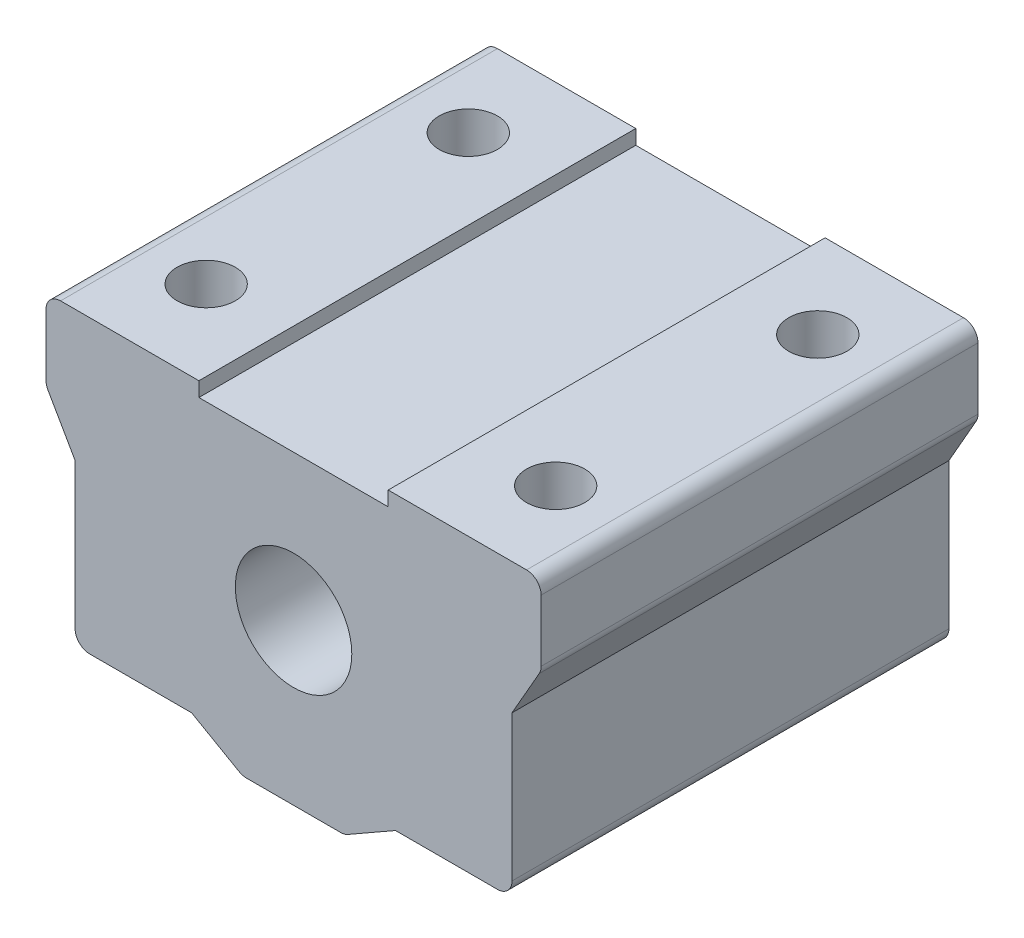
from build123d import *

# Parameters (mm, degrees)
BOSS_EXTRUDE1_DEPTH = 30
FILLET1_R           = 1
CUT_EXTRUDE1_REACH  = 42.902
SKETCH2_R           = 4
CUT_EXTRUDE2_REACH  = 42.902
SKETCH3_R           = 2
SKETCH4_W           = 13
SKETCH4_H           = 30
CUT_EXTRUDE3_DEPTH  = 1


with BuildPart() as part:
    # Sketch1 → Boss-Extrude1 (new body)
    with BuildSketch(Plane.XY):
        Polygon((-17, 0), (17, 0), (17, -5.5), (15, -9), (15, -20), (7, -20), (3.5, -22), (-3.5, -22), (-7, -20), (-15, -20), (-15, -9), (-17, -5.5), align=None)
    extrude(amount=BOSS_EXTRUDE1_DEPTH)

    # Fillet1
    fillet1_edges = [part.edges().sort_by_distance(p)[0] for p in [
        (-17, 0, 15),
        (17, 0, 15),
        (17, -5.5, 15),
        (15, -20, 15),
        (3.5, -22, 15),
        (-3.5, -22, 15),
        (-15, -20, 15),
        (-17, -5.5, 15),
    ]]
    fillet(fillet1_edges, radius=FILLET1_R)

    # Sketch2 → Cut-Extrude1 (cut, up to next)
    with BuildSketch(Plane.XY.offset(30), mode=Mode.PRIVATE) as cut_extrude1_sk1:
        with Locations((0, -11)):
            Circle(SKETCH2_R)
    cut_extrude1_tool1 = extrude(cut_extrude1_sk1.sketch, amount=-CUT_EXTRUDE1_REACH, mode=Mode.PRIVATE) & part.part
    add(cut_extrude1_tool1.solids().sort_by_distance((0, -11, 30))[0], mode=Mode.SUBTRACT)

    # Sketch3 → Cut-Extrude2 (cut, up to next)
    with BuildSketch(Plane(origin=(0, 0, 0), x_dir=(1, 0, 0), z_dir=(0, 1, 0)), mode=Mode.PRIVATE) as cut_extrude2_sk1:
        with Locations(Location((-12, -6, 0), (0, 0, 180))):
            Circle(SKETCH3_R)
    cut_extrude2_tool1 = extrude(cut_extrude2_sk1.sketch, amount=-CUT_EXTRUDE2_REACH, mode=Mode.PRIVATE) & part.part
    # Sketch3 → Cut-Extrude2 (cut, up to next)
    with BuildSketch(Plane(origin=(0, 0, 0), x_dir=(1, 0, 0), z_dir=(0, 1, 0)), mode=Mode.PRIVATE) as cut_extrude2_sk2:
        with Locations(Location((-12, -24, 0), (0, 0, 180))):
            Circle(SKETCH3_R)
    cut_extrude2_tool2 = extrude(cut_extrude2_sk2.sketch, amount=-CUT_EXTRUDE2_REACH, mode=Mode.PRIVATE) & part.part
    # Sketch3 → Cut-Extrude2 (cut, up to next)
    with BuildSketch(Plane(origin=(0, 0, 0), x_dir=(1, 0, 0), z_dir=(0, 1, 0)), mode=Mode.PRIVATE) as cut_extrude2_sk3:
        with Locations(Location((12, -24, 0), (0, 0, 180))):
            Circle(SKETCH3_R)
    cut_extrude2_tool3 = extrude(cut_extrude2_sk3.sketch, amount=-CUT_EXTRUDE2_REACH, mode=Mode.PRIVATE) & part.part
    # Sketch3 → Cut-Extrude2 (cut, up to next)
    with BuildSketch(Plane(origin=(0, 0, 0), x_dir=(1, 0, 0), z_dir=(0, 1, 0)), mode=Mode.PRIVATE) as cut_extrude2_sk4:
        with Locations(Location((12, -6, 0), (0, 0, 180))):
            Circle(SKETCH3_R)
    cut_extrude2_tool4 = extrude(cut_extrude2_sk4.sketch, amount=-CUT_EXTRUDE2_REACH, mode=Mode.PRIVATE) & part.part
    add(cut_extrude2_tool1.solids().sort_by_distance((-12, 0, 6))[0], mode=Mode.SUBTRACT)
    add(cut_extrude2_tool2.solids().sort_by_distance((-12, 0, 24))[0], mode=Mode.SUBTRACT)
    add(cut_extrude2_tool3.solids().sort_by_distance((12, 0, 24))[0], mode=Mode.SUBTRACT)
    add(cut_extrude2_tool4.solids().sort_by_distance((12, 0, 6))[0], mode=Mode.SUBTRACT)

    # Sketch4 → Cut-Extrude3 (cut)
    with BuildSketch(Plane(origin=(0, 0, 0), x_dir=(1, 0, 0), z_dir=(0, 1, 0))):
        with Locations((0, -15)):
            Rectangle(SKETCH4_W, SKETCH4_H)
    extrude(amount=-CUT_EXTRUDE3_DEPTH, mode=Mode.SUBTRACT)


solid = part.part
